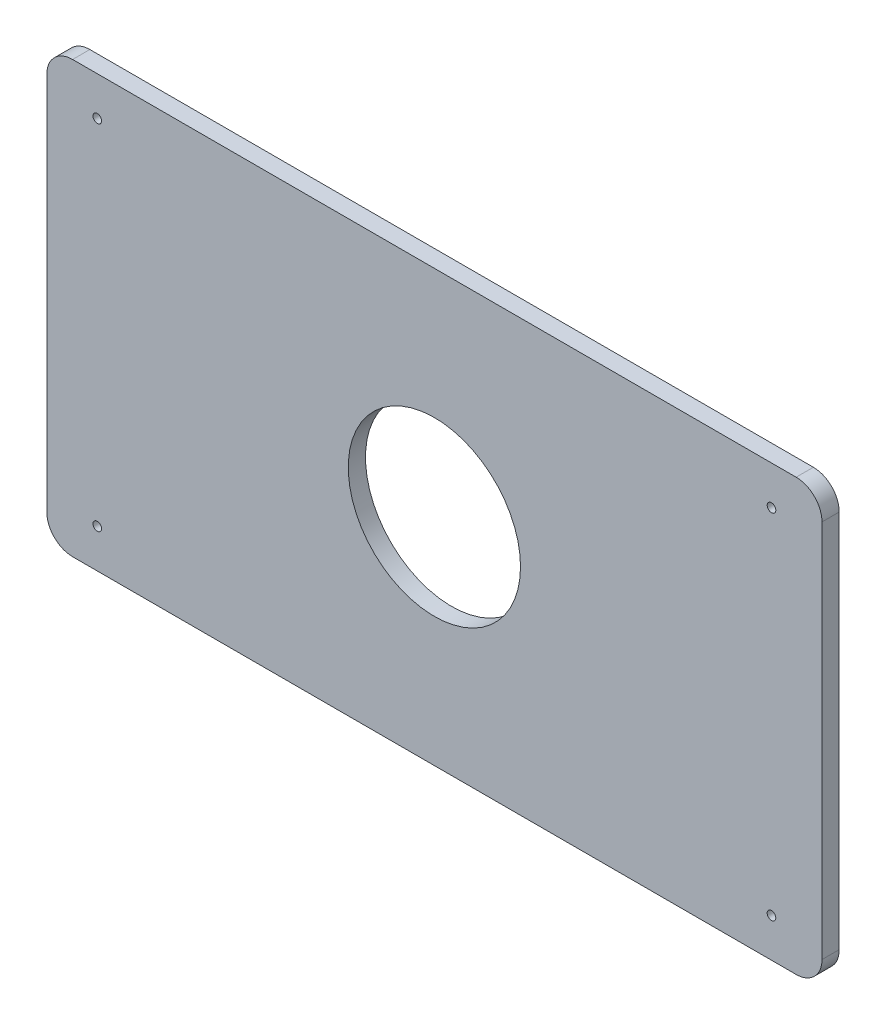
from build123d import *

# Parameters (mm, degrees)
CROQUIS1_R              = 50
SALIENTE_EXTRUIR1_DEPTH = 10
CROQUIS2_R              = 2.5
CORTAR_EXTRUIR1_DEPTH   = 10


with BuildPart() as part:
    # Croquis1 → Saliente-Extruir1 (new body)
    with BuildSketch(Plane.XY):
        with BuildLine():
            Line((15, 0), (435, 0))
            ThreePointArc((435, 0), (445.606601718, 4.393398282), (450, 15))
            Line((450, 15), (450, 235))
            ThreePointArc((450, 235), (445.606601718, 245.606601718), (435, 250))
            Line((435, 250), (15, 250))
            ThreePointArc((15, 250), (4.393398282, 245.606601718), (0, 235))
            Line((0, 235), (0, 15))
            ThreePointArc((0, 15), (4.393398282, 4.393398282), (15, 0))
        make_face()
        with Locations((225, 125)):
            Circle(CROQUIS1_R, mode=Mode.SUBTRACT)
    extrude(amount=SALIENTE_EXTRUIR1_DEPTH)

    # Croquis2 → Cortar-Extruir1 (cut)
    with BuildSketch(Plane.XY.offset(10)):
        with Locations((420.681818182, 22.5)):
            Circle(CROQUIS2_R)
        with Locations((420.681818182, 227.5)):
            Circle(CROQUIS2_R)
        with Locations(Location((29.318181818, 227.5, 0), (0, 0, 180))):
            Circle(CROQUIS2_R)
        with Locations(Location((29.318181818, 22.5, 0), (0, 0, 180))):
            Circle(CROQUIS2_R)
    extrude(amount=-CORTAR_EXTRUIR1_DEPTH, mode=Mode.SUBTRACT)


solid = part.part
